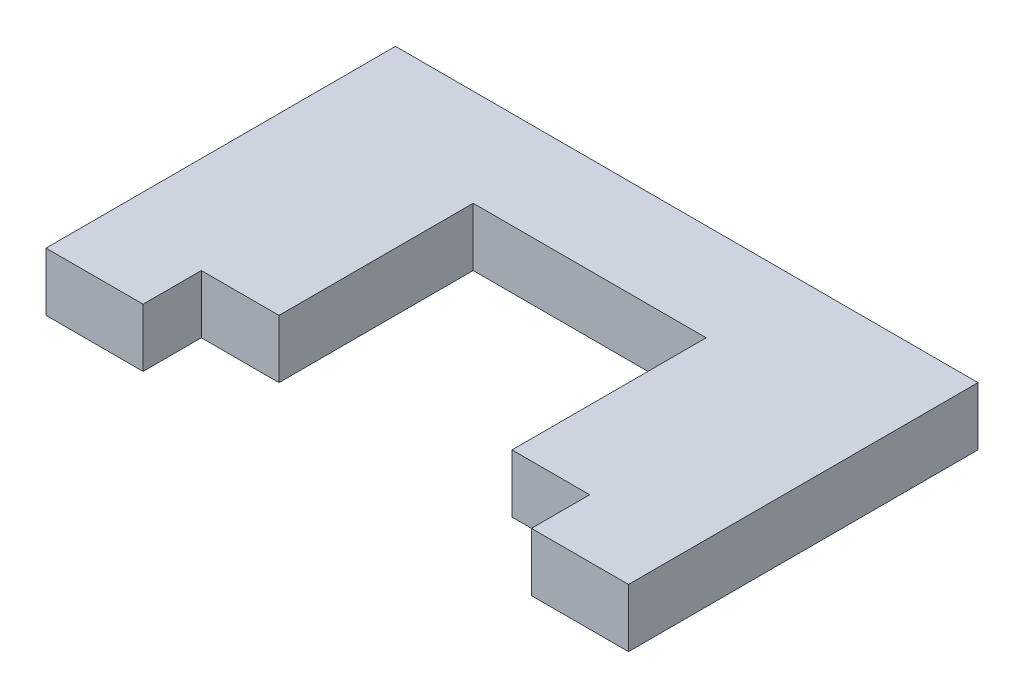
from build123d import *

# Parameters (mm, degrees)
BOSS_EXTRUDE1_DEPTH = 3
SKETCH2_W           = 12
SKETCH2_H           = 10
CUT_EXTRUDE1_DEPTH  = 3


with BuildPart() as part:
    # Sketch1 → Boss-Extrude1 (new body)
    with BuildSketch(Plane(origin=(0, 0, 0), x_dir=(1, 0, 0), z_dir=(0, 1, 0))):
        Polygon((-15, 9), (-15, -9), (-10, -9), (-10, -6), (10, -6), (10, -9), (15, -9), (15, 9), align=None)
    extrude(amount=BOSS_EXTRUDE1_DEPTH)

    # Sketch2 → Cut-Extrude1 (cut)
    with BuildSketch(Plane(origin=(0, 3, 0), x_dir=(1, 0, 0), z_dir=(0, 1, 0))):
        with Locations((0, -1)):
            Rectangle(SKETCH2_W, SKETCH2_H)
    extrude(amount=-CUT_EXTRUDE1_DEPTH, mode=Mode.SUBTRACT)


solid = part.part
